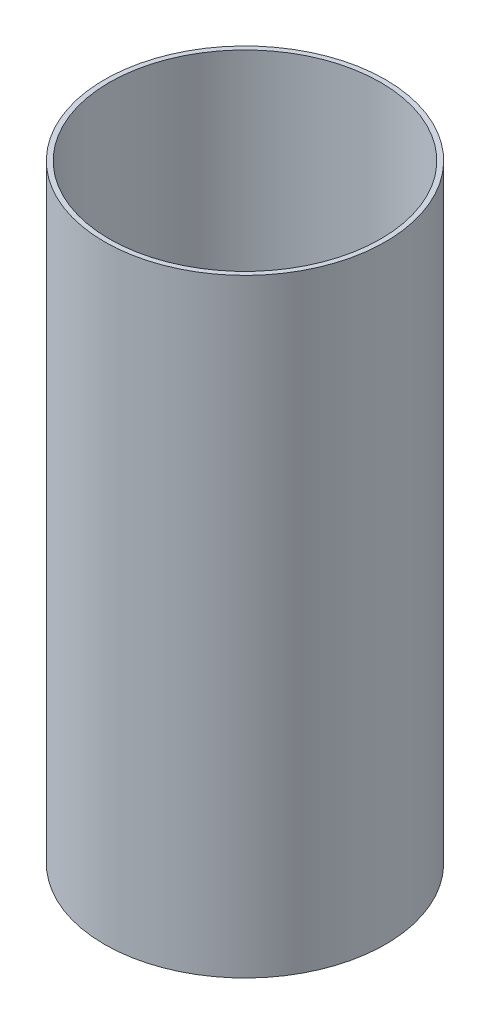
from build123d import *

# Parameters (mm, degrees)
SKETCH1_R           = 92.075
SKETCH1_R_2         = 88.9
BOSS_EXTRUDE1_DEPTH = 199.39


with BuildPart() as part:
    # Sketch1 → Boss-Extrude1 (new, symmetric)
    with BuildSketch(Plane(origin=(0, 0, 0), x_dir=(1, 0, 0), z_dir=(0, 1, 0))):
        with Locations(Location((0, 0, 0), (0, 0, 270))):
            Circle(SKETCH1_R)
        with Locations(Location((0, 0, 0), (0, 0, 270))):
            Circle(SKETCH1_R_2, mode=Mode.SUBTRACT)
    extrude(amount=BOSS_EXTRUDE1_DEPTH, both=True)


solid = part.part
